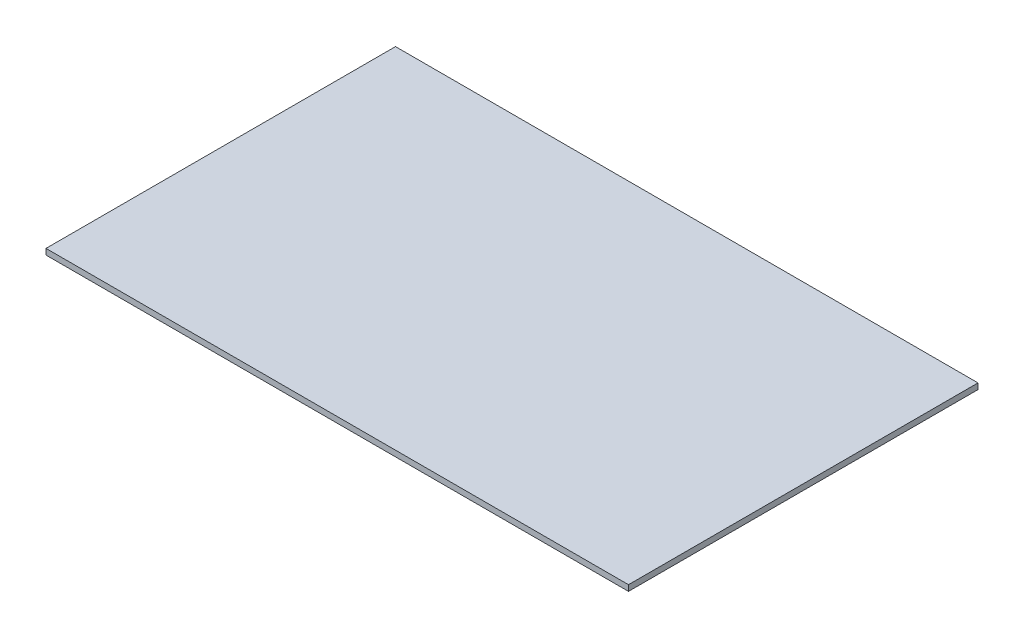
from build123d import *

# Parameters (mm, degrees)
CROQUIS1_W              = 500
CROQUIS1_H              = 300
SALIENTE_EXTRUIR1_DEPTH = 5


with BuildPart() as part:
    # Croquis1 → Saliente-Extruir1 (new body)
    with BuildSketch(Plane(origin=(0, 0, 0), x_dir=(1, 0, 0), z_dir=(0, 1, 0))):
        Rectangle(CROQUIS1_W, CROQUIS1_H)
    extrude(amount=SALIENTE_EXTRUIR1_DEPTH)


solid = part.part
